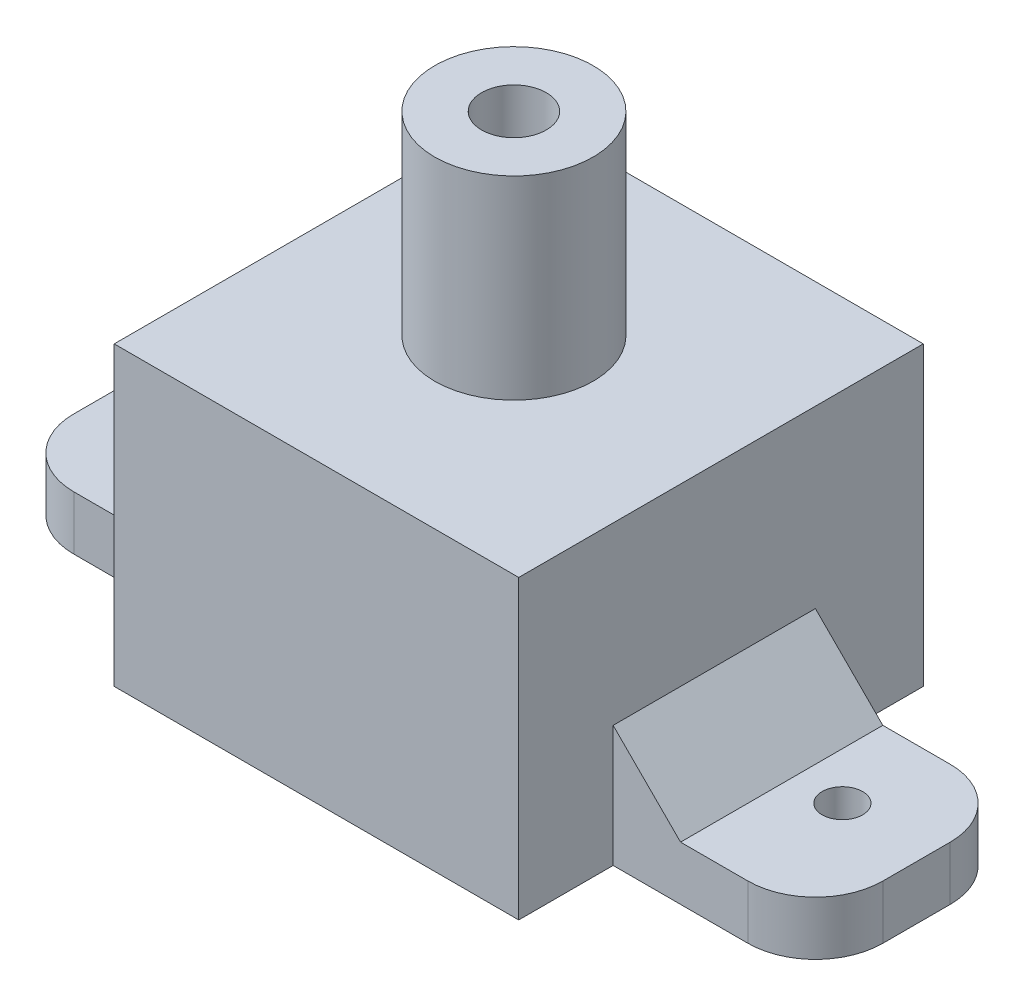
from build123d import *

# Parameters (mm, degrees)
SKETCH_1_W               = 30
SKETCH_1_H               = 30
EXTRUDE_289_DEPTH        = 22
SKETCH_2_R               = 5.875
EXTRUDE_2_DEPTH          = 14.4
EXTRUDE_4_DEPTH          = 4
CUT_EXTRUDE_2_DEPTH      = 48.211296398
CUT_EXTRUDE_2_DEPTH_BACK = 48.211296398
SKETCH_6_R               = 1.5
CHAMFER_2_SIZE           = 5
CHAMFER_3_SIZE           = 5
SKETCH_4_R               = 2.4
CUT_EXTRUDE_3_DEPTH      = 8


with BuildPart() as part:
    # Эскиз1 → Extrude 289 (new body)
    with BuildSketch(Plane(origin=(0, 0, 0), x_dir=(1, 0, 0), z_dir=(0, 1, 0))):
        with Locations((0.713469456, -0.356734728)):
            Rectangle(SKETCH_1_W, SKETCH_1_H)
    extrude(amount=EXTRUDE_289_DEPTH)

    # Эскиз2 → Бобышка-Вытянуть2 (add)
    with BuildSketch(Plane(origin=(0, 22, 0), x_dir=(1, 0, 0), z_dir=(0, 1, 0))):
        with Locations(Location((0, 0, 0), (0, 0, 270))):
            Circle(SKETCH_2_R)
    extrude(amount=EXTRUDE_2_DEPTH)

    # Эскиз5 → Бобышка-Вытянуть4 (add)
    with BuildSketch(Plane.XZ):
        with BuildLine():
            Line((15.713469456, 8.356734728), (25.713469456, 8.356734728))
            ThreePointArc((25.713469456, 8.356734728), (29.249003362, 6.892268634), (30.713469456, 3.356734728))
            Line((30.713469456, 3.356734728), (30.713469456, -1.643265272))
            ThreePointArc((30.713469456, -1.643265272), (29.249003362, -5.178799178), (25.713469456, -6.643265272))
            Line((25.713469456, -6.643265272), (15.713469456, -6.643265272))
            Line((15.713469456, -6.643265272), (15.713469456, 8.356734728))
        make_face()
        with BuildLine():
            Line((-14.286530544, 8.356734728), (-24.286530544, 8.356734728))
            ThreePointArc((-24.286530544, 8.356734728), (-27.82206445, 6.892268634), (-29.286530544, 3.356734728))
            Line((-29.286530544, 3.356734728), (-29.286530544, -1.643265272))
            ThreePointArc((-29.286530544, -1.643265272), (-27.82206445, -5.178799178), (-24.286530544, -6.643265272))
            Line((-24.286530544, -6.643265272), (-14.286530544, -6.643265272))
            Line((-14.286530544, -6.643265272), (-14.286530544, 8.356734728))
        make_face()
    extrude(amount=-EXTRUDE_4_DEPTH)

    # Эскиз6 → Вырез-Вытянуть2 (cut, two sides: drawn at the far end of the back side and taken through both)
    with BuildSketch(Plane(origin=(0, 4, 0), x_dir=(1, 0, 0), z_dir=(0, 1, 0)).offset(-CUT_EXTRUDE_2_DEPTH_BACK)):
        with Locations(Location((24.213469456, 0.143265272, 0), (0, 0, 270))):
            Circle(SKETCH_6_R)
        with Locations(Location((-22.786530544, 0.143265272, 0), (0, 0, 270))):
            Circle(SKETCH_6_R)
    extrude(amount=CUT_EXTRUDE_2_DEPTH + CUT_EXTRUDE_2_DEPTH_BACK, mode=Mode.SUBTRACT)

    # Фаска2
    chamfer_2_edges = [part.edges().sort_by_distance(p)[0] for p in [
        (15.713469456, 4, 0.856734728),
    ]]
    chamfer(chamfer_2_edges, length=CHAMFER_2_SIZE)

    # Фаска3
    chamfer_3_edges = [part.edges().sort_by_distance(p)[0] for p in [
        (-14.286530544, 4, 0.856734728),
    ]]
    chamfer(chamfer_3_edges, length=CHAMFER_3_SIZE)

    # Эскиз4 → Вырез-Вытянуть3 (cut)
    with BuildSketch(Plane(origin=(0, 36.4, 0), x_dir=(1, 0, 0), z_dir=(0, 1, 0))):
        with Locations(Location((0, 0, 0), (0, 0, 270))):
            Circle(SKETCH_4_R)
    extrude(amount=-CUT_EXTRUDE_3_DEPTH, mode=Mode.SUBTRACT)


solid = part.part
